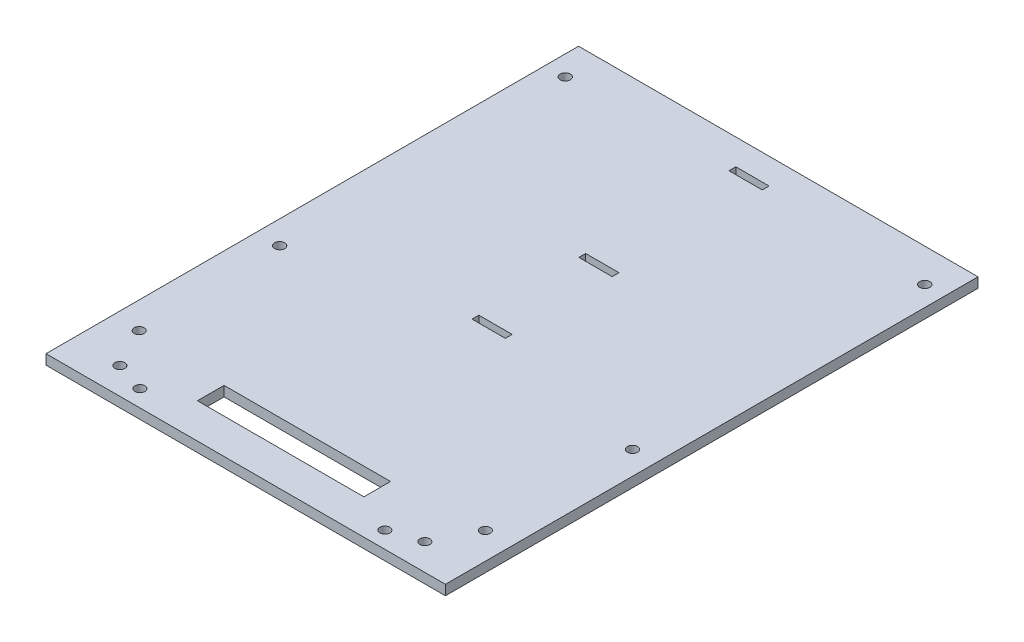
from build123d import *

# Parameters (mm, degrees)
SKETCH1_W           = 120
SKETCH1_H           = 160
BOSS_EXTRUDE1_DEPTH = 3
SKETCH2_R           = 1.525
CUT_EXTRUDE1_DEPTH  = 101.04498988
SKETCH3_W           = 10
SKETCH3_H           = 2.05
CUT_EXTRUDE2_DEPTH  = 101.04498988
SKETCH4_R           = 1.5
CUT_EXTRUDE3_DEPTH  = 3
SKETCH5_R           = 1.5
SKETCH5_W           = 50
SKETCH5_H           = 8
CUT_EXTRUDE4_DEPTH  = 3


with BuildPart() as part:
    # Sketch1 → Boss-Extrude1 (new body)
    with BuildSketch(Plane(origin=(0, 0, 0), x_dir=(1, 0, 0), z_dir=(0, 1, 0))):
        Rectangle(SKETCH1_W, SKETCH1_H)
    extrude(amount=BOSS_EXTRUDE1_DEPTH)

    # Sketch2 → Cut-Extrude1 (cut, through all)
    with BuildSketch(Plane(origin=(0, 3, 0), x_dir=(1, 0, 0), z_dir=(0, 1, 0))):
        with Locations(Location((-53, -16.81, 0), (0, 0, 270))):
            Circle(SKETCH2_R)
        with Locations(Location((-54, 70, 0), (0, 0, 270))):
            Circle(SKETCH2_R)
        with Locations(Location((53, -16.81, 0), (0, 0, 90))):
            Circle(SKETCH2_R)
        with Locations(Location((54, 70, 0), (0, 0, 90))):
            Circle(SKETCH2_R)
    extrude(amount=-CUT_EXTRUDE1_DEPTH, mode=Mode.SUBTRACT)

    # Sketch3 → Cut-Extrude2 (cut, through all)
    with BuildSketch(Plane(origin=(0, 3, 0), x_dir=(1, 0, 0), z_dir=(0, 1, 0))):
        with Locations((0, 26.115)):
            Rectangle(SKETCH3_W, SKETCH3_H)
        with Locations((0, -5.985)):
            Rectangle(SKETCH3_W, SKETCH3_H)
        with Locations((0, 71.215)):
            Rectangle(SKETCH3_W, SKETCH3_H)
    extrude(amount=-CUT_EXTRUDE2_DEPTH, mode=Mode.SUBTRACT)

    # Sketch4 → Cut-Extrude3 (cut)
    with BuildSketch(Plane(origin=(0, 3, 0), x_dir=(1, 0, 0), z_dir=(0, 1, 0))):
        with Locations(Location((-52, -60, 0), (0, 0, 270))):
            Circle(SKETCH4_R)
        with Locations(Location((-45.815341562, -72, 0), (0, 0, 270))):
            Circle(SKETCH4_R)
        with Locations(Location((45.815341562, -72, 0), (0, 0, 90))):
            Circle(SKETCH4_R)
        with Locations(Location((52, -60, 0), (0, 0, 90))):
            Circle(SKETCH4_R)
    extrude(amount=-CUT_EXTRUDE3_DEPTH, mode=Mode.SUBTRACT)

    # Sketch5 → Cut-Extrude4 (cut)
    with BuildSketch(Plane(origin=(0, 3, 0), x_dir=(1, 0, 0), z_dir=(0, 1, 0))):
        with Locations(Location((-36.8, -75, 0), (0, 0, 270))):
            Circle(SKETCH5_R)
        with Locations(Location((36.8, -75, 0), (0, 0, 90))):
            Circle(SKETCH5_R)
        with Locations((0, -65.5)):
            Rectangle(SKETCH5_W, SKETCH5_H)
    extrude(amount=-CUT_EXTRUDE4_DEPTH, mode=Mode.SUBTRACT)


solid = part.part
